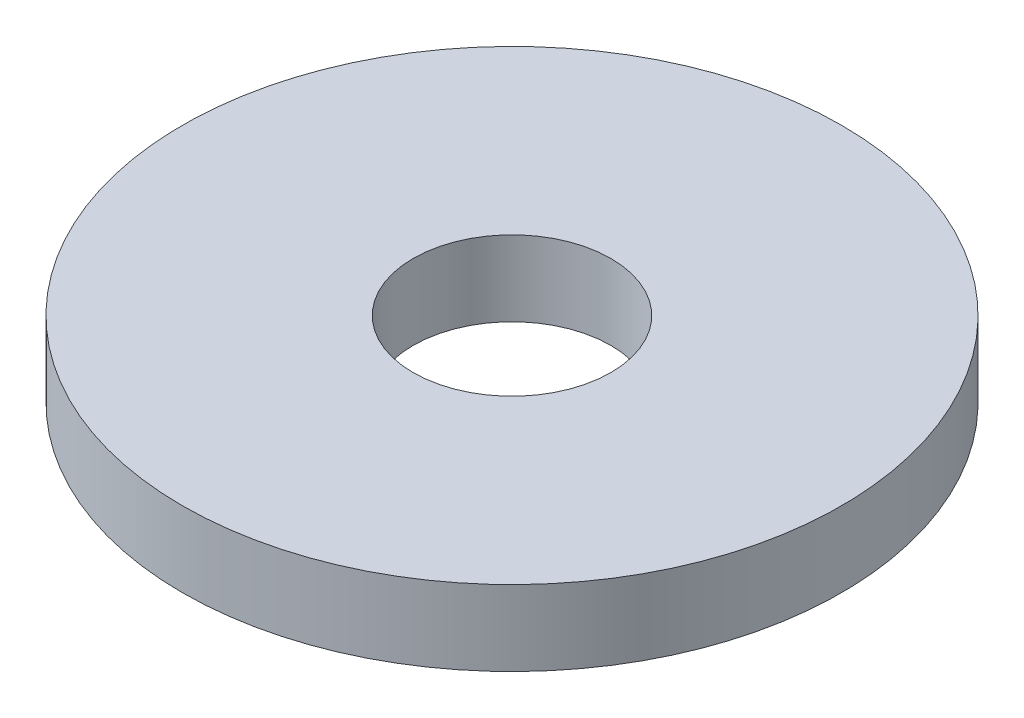
from build123d import *

# Parameters (mm, degrees)
SKETCH_2_R      = 7
SKETCH_2_R_2    = 2.1
EXTRUDE_2_DEPTH = 1.6


with BuildPart() as part:
    # ｽｹｯﾁ2 → ﾎﾞｽ - 押し出し2 (new body)
    with BuildSketch(Plane(origin=(0, 0, 0), x_dir=(-1, 0, 0), z_dir=(0, 1, 0))):
        with Locations(Location((0, 0, 0), (0, 0, 90))):
            Circle(SKETCH_2_R)
        with Locations(Location((0, 0, 0), (0, 0, 90))):
            Circle(SKETCH_2_R_2, mode=Mode.SUBTRACT)
    extrude(amount=EXTRUDE_2_DEPTH)


solid = part.part
